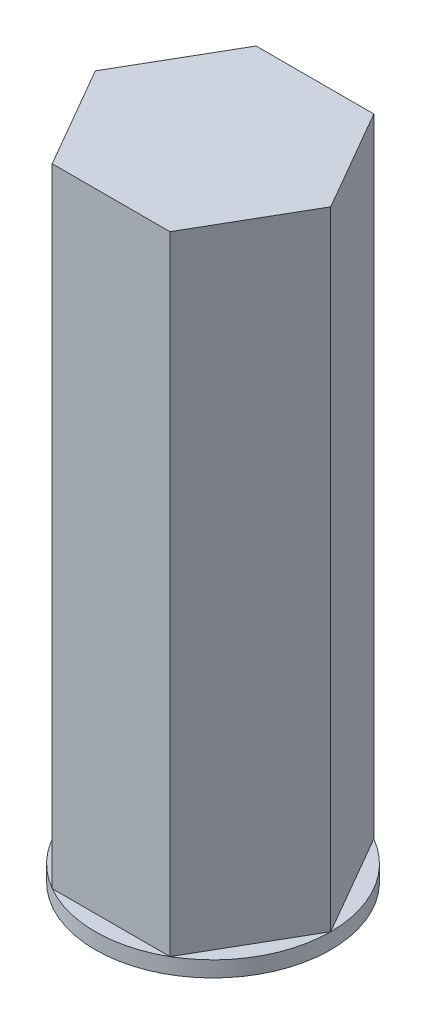
from build123d import *

# Parameters (mm, degrees)
SKETCH1_R           = 7.5
BOSS_EXTRUDE1_DEPTH = 1
BOSS_EXTRUDE2_DEPTH = 40


with BuildPart() as part:
    # Sketch1 → Boss-Extrude1 (new body)
    with BuildSketch(Plane(origin=(0, 0, 0), x_dir=(1, 0, 0), z_dir=(0, 1, 0))):
        with Locations(Location((0, 0, 0), (0, 0, 270))):
            Circle(SKETCH1_R)
    extrude(amount=BOSS_EXTRUDE1_DEPTH)

    # Sketch2 → Boss-Extrude2 (add)
    with BuildSketch(Plane(origin=(0, 1, 0), x_dir=(1, 0, 0), z_dir=(0, 1, 0))):
        Polygon((7.5, 0), (3.75, 6.495190528), (-3.75, 6.495190528), (-7.5, 0), (-3.75, -6.495190528), (3.75, -6.495190528), align=None)
    extrude(amount=BOSS_EXTRUDE2_DEPTH)


solid = part.part
